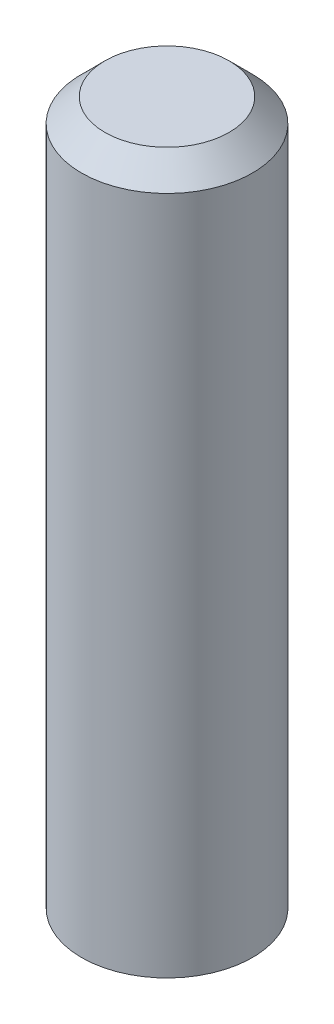
from build123d import *

# Parameters (mm, degrees)
SKETCH1_R           = 9.271
BOSS_EXTRUDE1_DEPTH = 76.2
CHAMFER2_SIZE       = 2.54


with BuildPart() as part:
    # Sketch1 → Boss-Extrude1 (new body)
    with BuildSketch(Plane(origin=(0, 0, 0), x_dir=(1, 0, 0), z_dir=(0, 1, 0))):
        with Locations(Location((0, 0, 0), (0, 0, 90))):
            Circle(SKETCH1_R)
    extrude(amount=BOSS_EXTRUDE1_DEPTH)

    # Chamfer2
    chamfer2_edges = [part.edges().sort_by_distance(p)[0] for p in [
        (0, 76.2, 9.271),
    ]]
    chamfer(chamfer2_edges, length=CHAMFER2_SIZE)


solid = part.part
